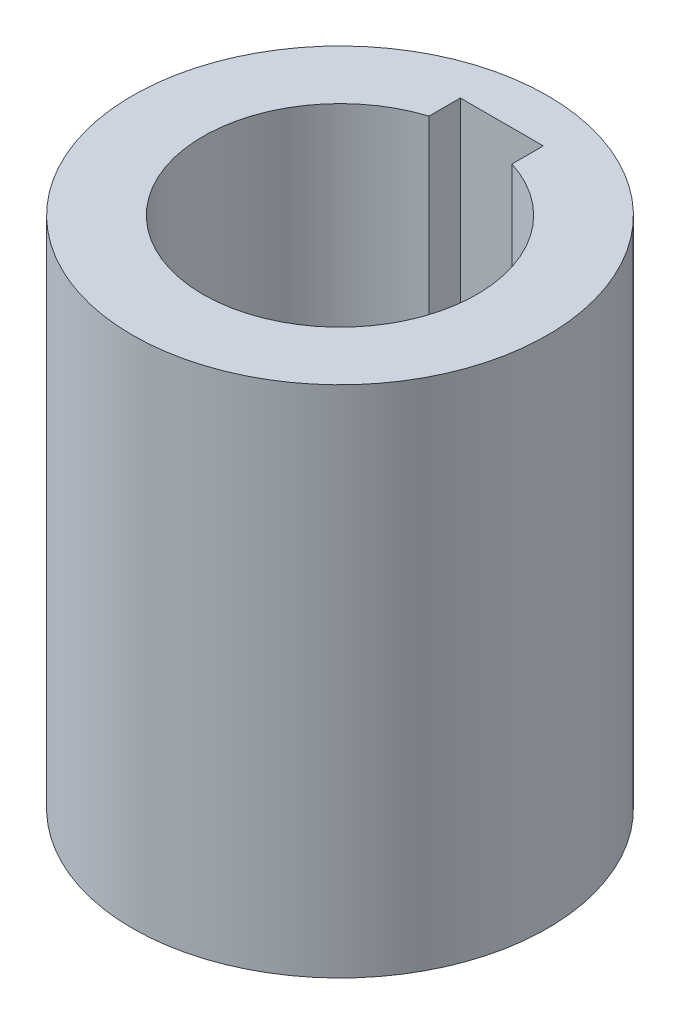
from build123d import *

# Parameters (mm, degrees)
SKETCH1_R               = 50
SKETCH1_R_2             = 33
BOSS_EXTRUDE1_DEPTH     = 123.8
CUT_EXTRUDE1_DEPTH      = 143.570824505
CUT_EXTRUDE1_DEPTH_BACK = 143.570824505
SKETCH2_W               = 20
SKETCH2_H               = 12


with BuildPart() as part:
    # Sketch1 → Boss-Extrude1 (new body)
    with BuildSketch(Plane(origin=(0, 0, 0), x_dir=(1, 0, 0), z_dir=(0, 1, 0))):
        with Locations(Location((0, 0, 0), (0, 0, 270))):
            Circle(SKETCH1_R)
        with Locations(Location((0, 0, 0), (0, 0, 270))):
            Circle(SKETCH1_R_2, mode=Mode.SUBTRACT)
    extrude(amount=BOSS_EXTRUDE1_DEPTH)

    # Sketch2 → Cut-Extrude1 (cut, two sides: drawn at the far end of the back side and taken through both)
    with BuildSketch(Plane(origin=(0, 123.8, 0), x_dir=(1, 0, 0), z_dir=(0, 1, 0)).offset(-CUT_EXTRUDE1_DEPTH_BACK)):
        with Locations((0, 33)):
            Rectangle(SKETCH2_W, SKETCH2_H)
    extrude(amount=CUT_EXTRUDE1_DEPTH + CUT_EXTRUDE1_DEPTH_BACK, mode=Mode.SUBTRACT)


solid = part.part
